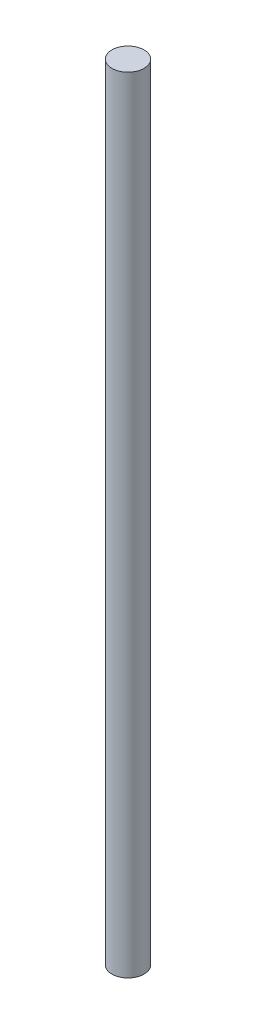
from build123d import *

# Parameters (mm, degrees)
SKETCH1_R           = 2.25
BOSS_EXTRUDE1_DEPTH = 110


with BuildPart() as part:
    # Sketch1 → Boss-Extrude1 (new body)
    with BuildSketch(Plane(origin=(0, 0, 0), x_dir=(1, 0, 0), z_dir=(0, 1, 0))):
        with Locations(Location((0, 0, 0), (0, 0, 270))):
            Circle(SKETCH1_R)
    extrude(amount=BOSS_EXTRUDE1_DEPTH)


solid = part.part
